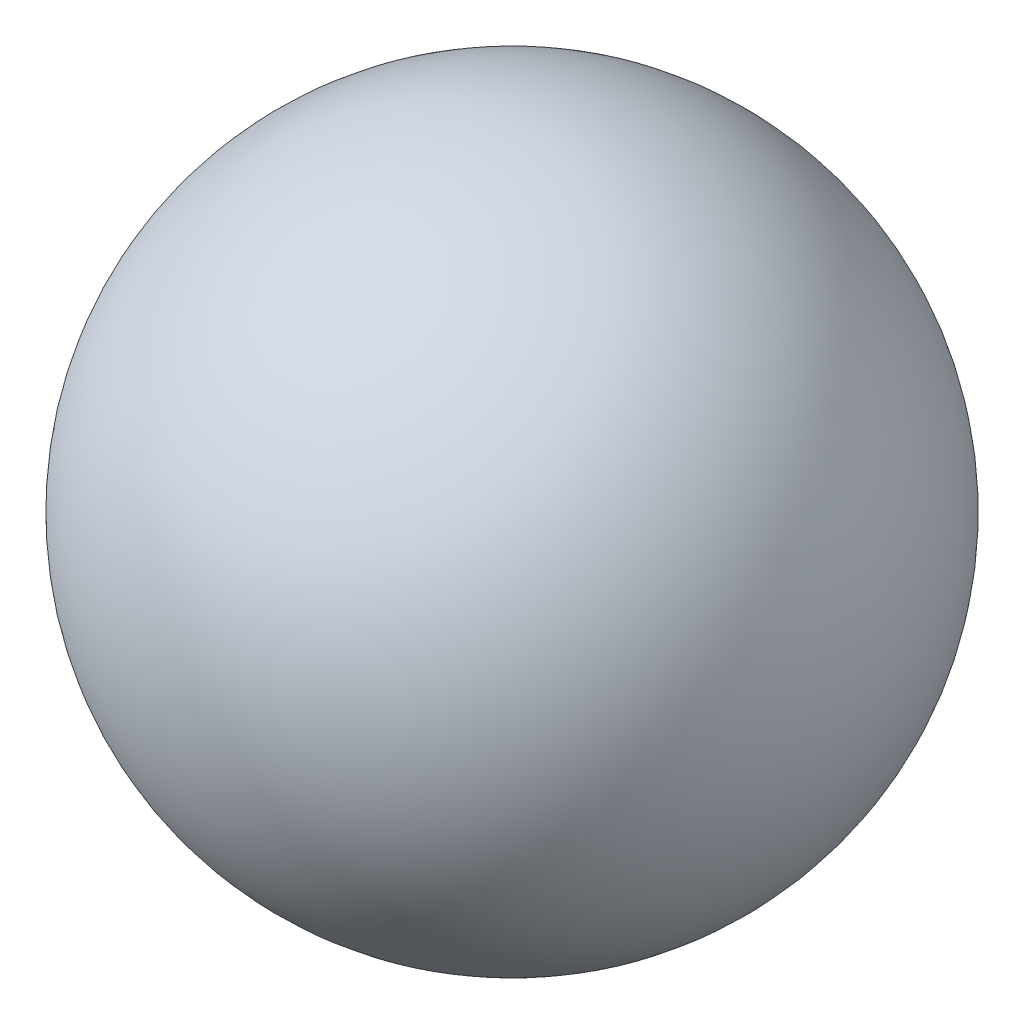
from build123d import *


with BuildPart() as part:
    # Esquisse1 → Révolution1 (revolve)
    with BuildSketch(Plane.XY):
        with BuildLine():
            Line((2, 3.7), (2, 1.8))
            ThreePointArc((2, 1.8), (1.05, 2.75), (2, 3.7))
        make_face()
    revolve(axis=Axis((2, 4, 0), (0, -1, 0)))


solid = part.part
